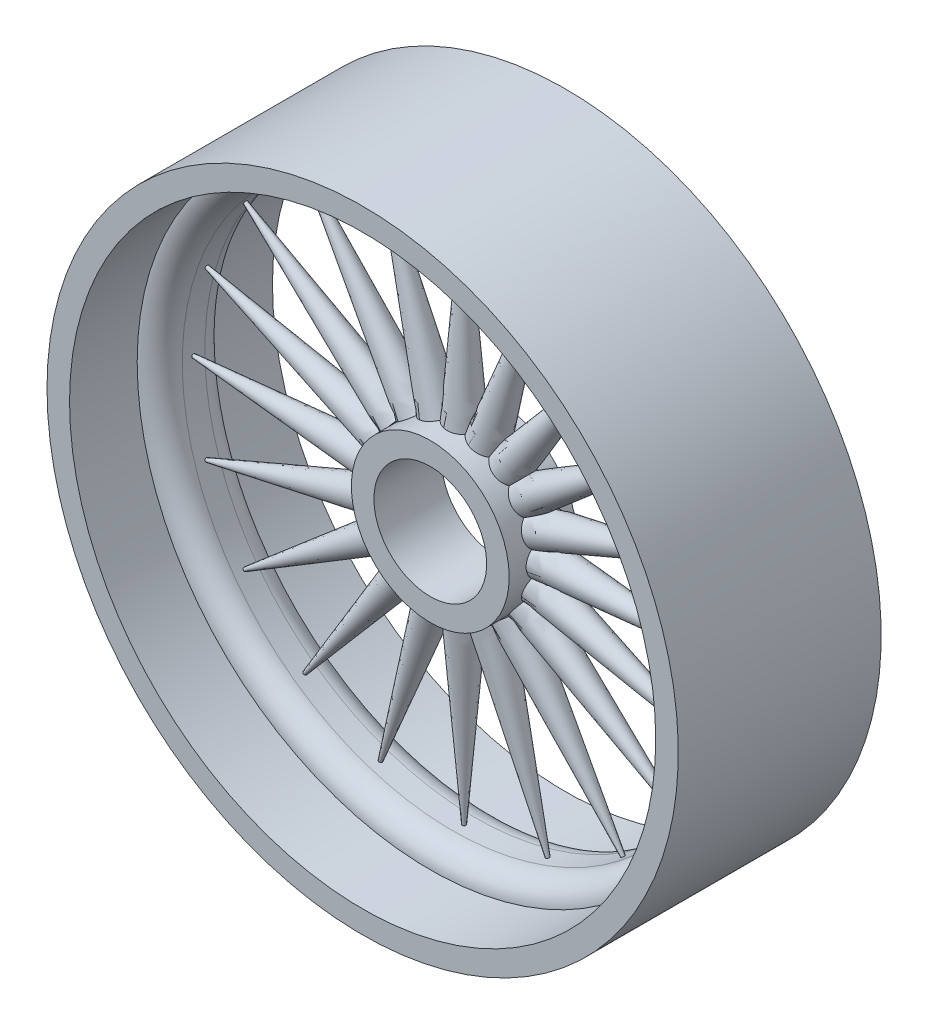
from build123d import *

# Parameters (mm, degrees)
SKETCH2_R                = 35.56
SKETCH2_R_2              = 6.35
BOSS_EXTRUDE1_DEPTH      = 3.81
CUT_EXTRUDE2_DEPTH       = 51.863460362
CUT_EXTRUDE2_DEPTH_BACK  = 51.863460362
SKETCH11_R               = 30.48
SKETCH11_R_2             = 8.89
FILLET1_R                = 2.54
BOSS_EXTRUDE3_DEPTH      = 7.62
BOSS_EXTRUDE3_DEPTH_BACK = 15.24
SKETCH19_R               = 35.56
SKETCH19_R_2             = 33.02
CIRPATTERN1_COUNT        = 20


with BuildPart() as part:
    # Sketch2 → Boss-Extrude1 (new, symmetric)
    with BuildSketch(Plane.XY):
        Circle(SKETCH2_R)
        Circle(SKETCH2_R_2, mode=Mode.SUBTRACT)
    extrude(amount=BOSS_EXTRUDE1_DEPTH, both=True)

    # Sketch11 → Cut-Extrude2 (cut, two sides: drawn at the far end of the back side and taken through both)
    with BuildSketch(Plane.XY.offset(3.81).offset(-CUT_EXTRUDE2_DEPTH_BACK)):
        Circle(SKETCH11_R)
        Circle(SKETCH11_R_2, mode=Mode.SUBTRACT)
    extrude(amount=CUT_EXTRUDE2_DEPTH + CUT_EXTRUDE2_DEPTH_BACK, mode=Mode.SUBTRACT)


with BuildPart() as cut_extrude2_piece_1:
    # of the separate pieces the step leaves, piece 1, a body of its own (cut_extrude2_pieces)
    add(part.part.solids().sort_by_distance((35.56, 0, -3.81))[0])

    # Fillet1
    fillet1_edges = [cut_extrude2_piece_1.edges().sort_by_distance(p)[0] for p in [
        (-30.48, 0, 3.81),
        (-30.48, 0, -3.81),
    ]]
    fillet(fillet1_edges, radius=FILLET1_R)

    # Sketch19 → Boss-Extrude3 (add, two sides: drawn at the far end of the back side and taken through both)
    with BuildSketch(Plane.XY.offset(3.81).offset(-BOSS_EXTRUDE3_DEPTH_BACK)):
        Circle(SKETCH19_R)
        Circle(SKETCH19_R_2, mode=Mode.SUBTRACT)
    extrude(amount=BOSS_EXTRUDE3_DEPTH + BOSS_EXTRUDE3_DEPTH_BACK)

    # Sketch20 → Revolve1 (revolve)
    with BuildSketch(Plane(origin=(0, 0, 0), x_dir=(1, 0, 0), z_dir=(0, 1, 0))):
        Polygon((-8.89, -1.905), (-8.89, 0), (-33.02, 0), align=None)
    revolve1 = revolve(axis=Axis((-8.89, 0, 0), (-1, 0, 0)))

    # CirPattern1: Revolve1 ×20 about axis
    cirpattern1_axis = Axis((0, 0, 3.81), (0, 0, -1))
    for i in range(1, CIRPATTERN1_COUNT):
        add(revolve1.rotate(cirpattern1_axis, i * 360 / CIRPATTERN1_COUNT))


with BuildPart() as cut_extrude2_piece_2:
    # of the separate pieces the step leaves, piece 2, a body of its own (cut_extrude2_pieces)
    add(part.part.solids().sort_by_distance((8.89, 0, -3.81))[0])


solid = Compound([cut_extrude2_piece_1.part, cut_extrude2_piece_2.part])
